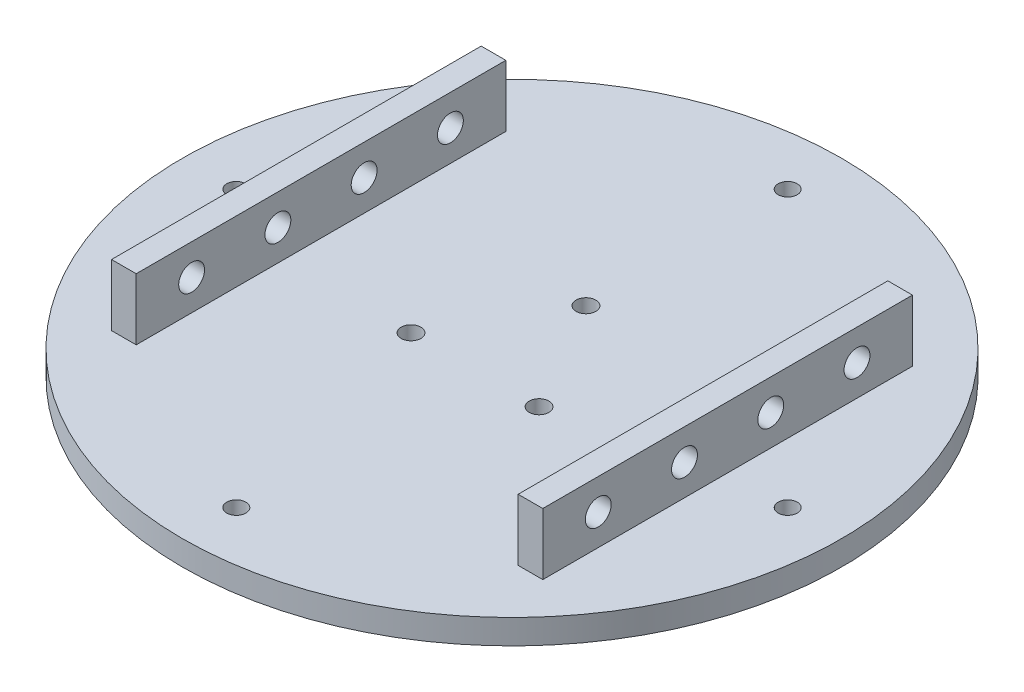
from build123d import *

# Parameters (mm, degrees)
SKETCH_1_R             = 53.491930893
SKETCH_1_R_2           = 1.55
SKETCH_1_R_3           = 1.6
EXTRUDE_563_DEPTH      = 4
SKETCH_2_W             = 4
SKETCH_2_H             = 60
EXTRUDE_829_DEPTH      = 10
SKETCH_3_R             = 2.1
CUT_EXTRUDE_1129_DEPTH = 105.346578783


with BuildPart() as part:
    # 草图1 → Extrude 563 (new body)
    with BuildSketch(Plane(origin=(0, 0, 0), x_dir=(1, 0, 0), z_dir=(0, 1, 0))):
        with Locations(Location((0, 0, 0), (0, 0, 270))):
            Circle(SKETCH_1_R)
        with Locations(Location((0, 44.75, 0), (0, 0, 270))):
            Circle(SKETCH_1_R_2, mode=Mode.SUBTRACT)
        with Locations(Location((-44.75, 0, 0), (0, 0, 270))):
            Circle(SKETCH_1_R_2, mode=Mode.SUBTRACT)
        with Locations(Location((44.75, 0, 0), (0, 0, 90))):
            Circle(SKETCH_1_R_2, mode=Mode.SUBTRACT)
        with Locations(Location((0, -44.75, 0), (0, 0, 90))):
            Circle(SKETCH_1_R_2, mode=Mode.SUBTRACT)
        with Locations(Location((0, 12, 0), (0, 0, 270))):
            Circle(SKETCH_1_R_3, mode=Mode.SUBTRACT)
        with Locations(Location((10.392304845, -6, 0), (0, 0, 270))):
            Circle(SKETCH_1_R_3, mode=Mode.SUBTRACT)
        with Locations(Location((-10.392304845, -6, 0), (0, 0, 270))):
            Circle(SKETCH_1_R_3, mode=Mode.SUBTRACT)
    extrude(amount=EXTRUDE_563_DEPTH)

    # 草图2 → Extrude 829 (add)
    with BuildSketch(Plane(origin=(0, 4, 0), x_dir=(1, 0, 0), z_dir=(0, 1, 0))):
        with Locations((33, 0)):
            Rectangle(SKETCH_2_W, SKETCH_2_H)
        with Locations((-33, 0)):
            Rectangle(SKETCH_2_W, SKETCH_2_H)
    extrude(amount=EXTRUDE_829_DEPTH)

    # 草图3 → Cut-Extrude 1129 (cut, through all)
    with BuildSketch(Plane.ZY.offset(35)):
        with Locations((7, 9)):
            Circle(SKETCH_3_R)
        with Locations((-7, 9)):
            Circle(SKETCH_3_R)
        with Locations((-21, 9)):
            Circle(SKETCH_3_R)
        with Locations((21, 9)):
            Circle(SKETCH_3_R)
    extrude(amount=-CUT_EXTRUDE_1129_DEPTH, mode=Mode.SUBTRACT)


solid = part.part
